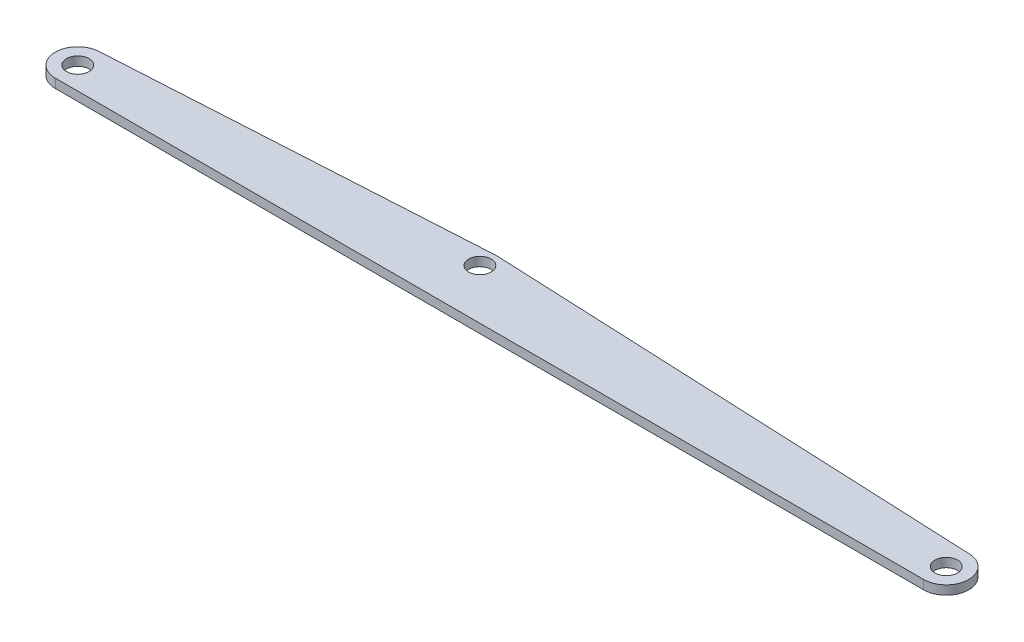
from build123d import *

# Parameters (mm, degrees)
SKETCH2_R           = 6.35
BOSS_EXTRUDE1_DEPTH = 5.08


with BuildPart() as part:
    # Sketch2 → Boss-Extrude1 (new body)
    with BuildSketch(Plane(origin=(0, 0, 0), x_dir=(1, 0, 0), z_dir=(0, 1, 0))):
        with BuildLine():
            Line((-489.9, -12.7), (0, -12.7))
            ThreePointArc((0, -12.7), (12.7, 0), (0, 12.7))
            Line((0, 12.7), (-278.146766675, 25.026940493))
            ThreePointArc((-278.146766675, 25.026940493), (-278.635611726, 25.036044186), (-279.124279899, 25.020051143))
            Line((-279.124279899, 25.020051143), (-489.9, 12.7))
            ThreePointArc((-489.9, 12.7), (-502.6, 0), (-489.9, -12.7))
        make_face()
        with Locations(Location((0, 0, 0), (0, 0, 270))):
            Circle(SKETCH2_R, mode=Mode.SUBTRACT)
        with Locations(Location((-489.9, 0, 0), (0, 0, 270))):
            Circle(SKETCH2_R, mode=Mode.SUBTRACT)
        with Locations(Location((-278.568482782, 15.51128074, 0), (0, 0, 270))):
            Circle(SKETCH2_R, mode=Mode.SUBTRACT)
    extrude(amount=BOSS_EXTRUDE1_DEPTH)


solid = part.part
